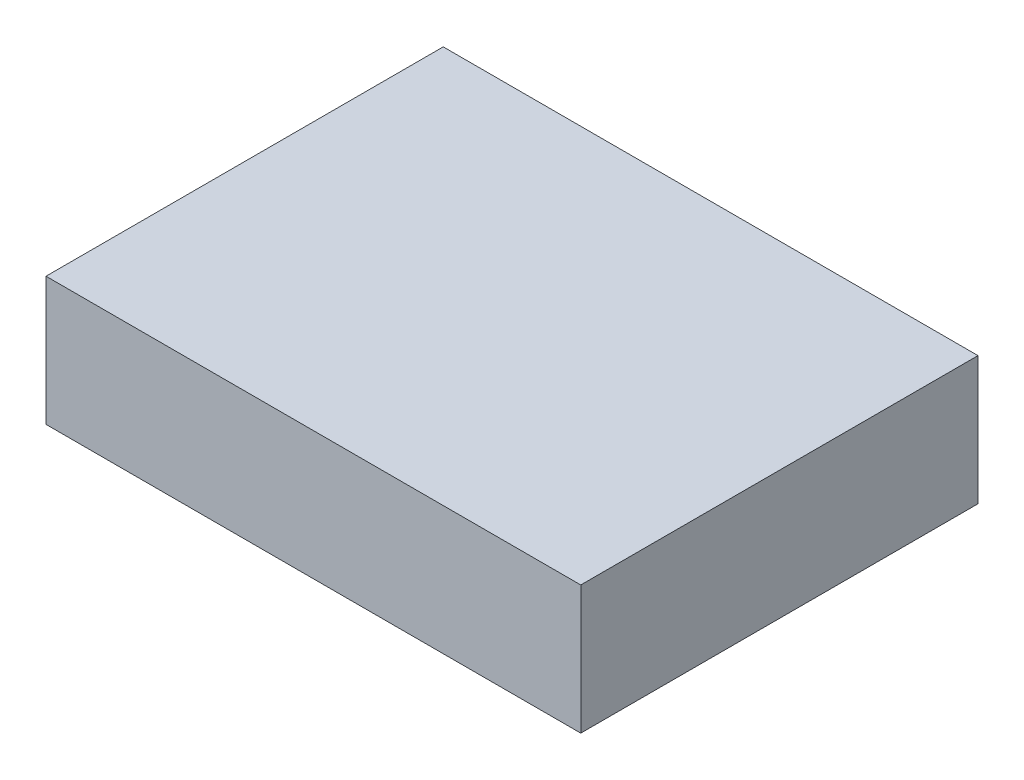
from build123d import *

# Parameters (mm, degrees)
SKETCH1_W           = 875
SKETCH1_H           = 650
BOSS_EXTRUDE1_DEPTH = 210


with BuildPart() as part:
    # Sketch1 → Boss-Extrude1 (new body)
    with BuildSketch(Plane(origin=(0, 0, 0), x_dir=(1, 0, 0), z_dir=(0, 1, 0))):
        with Locations((0, 325)):
            Rectangle(SKETCH1_W, SKETCH1_H)
    extrude(amount=-BOSS_EXTRUDE1_DEPTH)


solid = part.part
